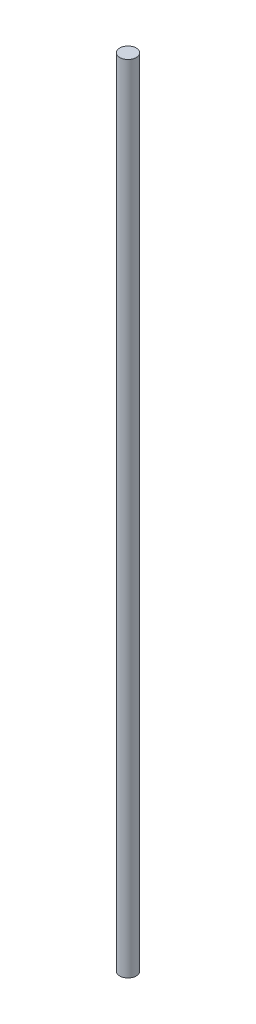
from build123d import *

# Parameters (mm, degrees)
SKETCH1_R           = 4
BOSS_EXTRUDE1_DEPTH = 385


with BuildPart() as part:
    # Sketch1 → Boss-Extrude1 (new body)
    with BuildSketch(Plane(origin=(0, 0, 0), x_dir=(1, 0, 0), z_dir=(0, 1, 0))):
        with Locations(Location((0, 0, 0), (0, 0, 270))):
            Circle(SKETCH1_R)
    extrude(amount=BOSS_EXTRUDE1_DEPTH)


solid = part.part
